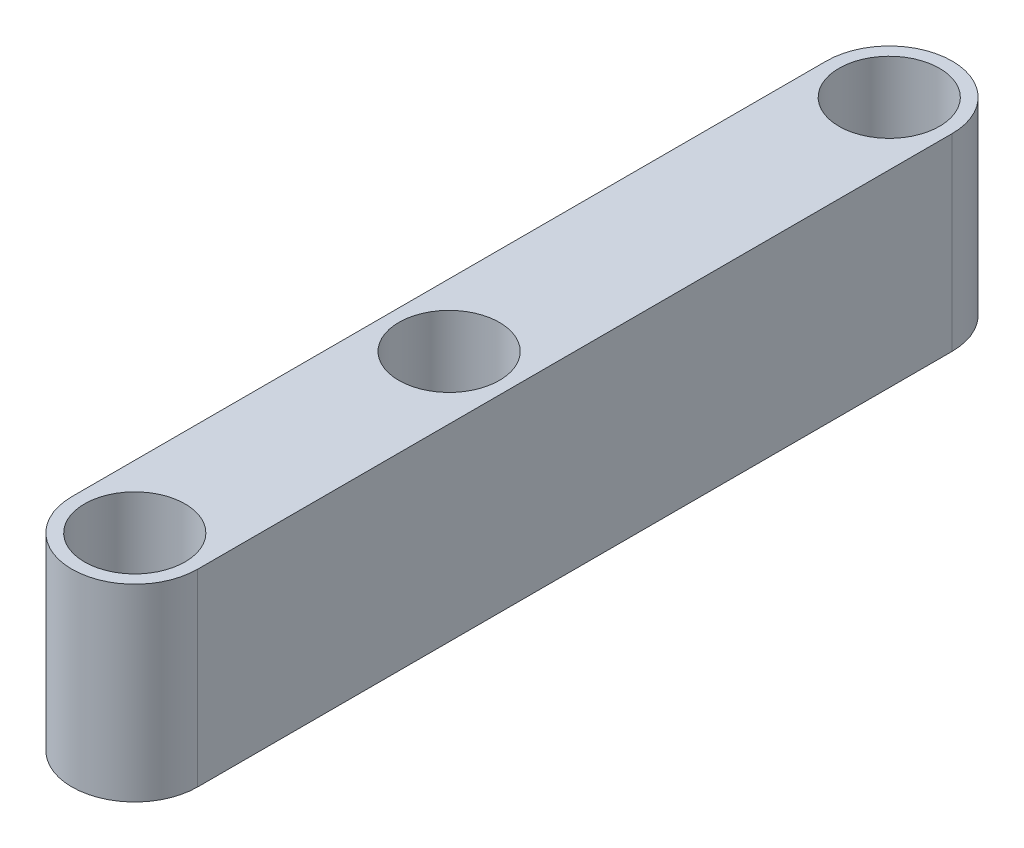
from build123d import *

# Parameters (mm, degrees)
SKETCH1_R           = 0.4
BOSS_EXTRUDE1_DEPTH = 1.5


with BuildPart() as part:
    # Sketch1 → Boss-Extrude1 (new body)
    with BuildSketch(Plane(origin=(0, 0, 0), x_dir=(1, 0, 0), z_dir=(0, 1, 0))):
        with BuildLine():
            Line((-35.917543993, 24.002085206), (-35.917543993, 30.002085206))
            ThreePointArc((-35.917543993, 30.002085206), (-36.417543993, 30.502085206), (-36.917543993, 30.002085206))
            Line((-36.917543993, 30.002085206), (-36.917543993, 24.002085206))
            ThreePointArc((-36.917543993, 24.002085206), (-36.417543993, 23.502085206), (-35.917543993, 24.002085206))
        make_face()
        with BuildLine():
            ThreePointArc((-36.017543993, 26.502085206), (-36.134701281, 26.219242493), (-36.417543993, 26.102085206))
            ThreePointArc((-36.417543993, 26.102085206), (-36.700386706, 26.784927918), (-36.017543993, 26.502085206))
        make_face(mode=Mode.SUBTRACT)
        with BuildLine():
            ThreePointArc((-36.017543993, 24.002085206), (-36.700386706, 23.719242493), (-36.417543993, 24.402085206))
            ThreePointArc((-36.417543993, 24.402085206), (-36.134701281, 24.284927918), (-36.017543993, 24.002085206))
        make_face(mode=Mode.SUBTRACT)
        with Locations((-36.417543993, 30.002085206)):
            Circle(SKETCH1_R, mode=Mode.SUBTRACT)
    extrude(amount=BOSS_EXTRUDE1_DEPTH)


solid = part.part
